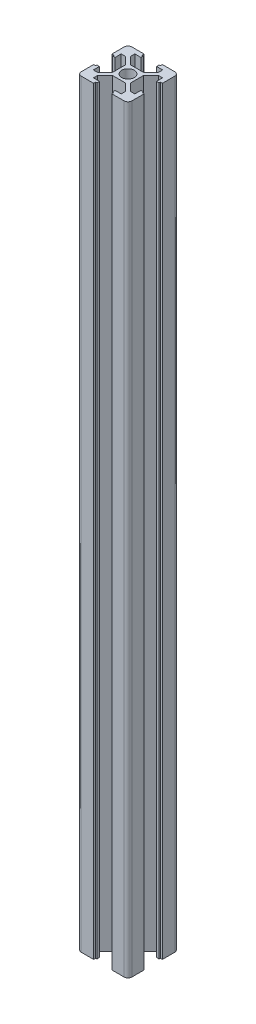
from build123d import *

# Parameters (mm, degrees)
SKETCH_1_R          = 2.5
EXTRUDE_1_DEPTH     = 300
SKETCH_2_R          = 1.75
CUT_EXTRUDE_1_DEPTH = 10


with BuildPart() as part:
    # 草图1 → 凸台-拉伸1 (new body)
    with BuildSketch(Plane(origin=(0, 0, 0), x_dir=(1, 0, 0), z_dir=(0, 1, 0))):
        with BuildLine():
            Line((-5.825824942, 5.993206118), (-5.825824942, 0.914526462))
            Line((-5.825824942, 0.914526462), (-8.786485114, -2.04613371))
            Line((-8.786485114, -2.04613371), (-10.425824942, -2.04613371))
            Line((-10.425824942, -2.04613371), (-10.425824942, 0.35386629))
            Line((-10.425824942, 0.35386629), (-11.425824942, 0.35386629))
            Line((-11.425824942, 0.35386629), (-11.425824942, -0.14613371))
            Line((-11.425824942, -0.14613371), (-12.225824942, -0.14613371))
            Line((-12.225824942, -0.14613371), (-12.225824942, -5.04613371))
            ThreePointArc((-12.225824942, -5.04613371), (-11.786485114, -6.106793882), (-10.725824942, -6.54613371))
            Line((-10.725824942, -6.54613371), (-5.825824942, -6.54613371))
            Line((-5.825824942, -6.54613371), (-5.825824942, -5.74613371))
            Line((-5.825824942, -5.74613371), (-5.325824942, -5.74613371))
            Line((-5.325824942, -5.74613371), (-5.325824942, -4.74613371))
            Line((-5.325824942, -4.74613371), (-7.725824942, -4.74613371))
            Line((-7.725824942, -4.74613371), (-7.725824942, -3.106793882))
            Line((-7.725824942, -3.106793882), (-4.765164771, -0.14613371))
            Line((-4.765164771, -0.14613371), (0.313514886, -0.14613371))
            Line((0.313514886, -0.14613371), (3.274175058, -3.106793882))
            Line((3.274175058, -3.106793882), (3.274175058, -4.74613371))
            Line((3.274175058, -4.74613371), (0.874175058, -4.74613371))
            Line((0.874175058, -4.74613371), (0.874175058, -5.74613371))
            Line((0.874175058, -5.74613371), (1.374175058, -5.74613371))
            Line((1.374175058, -5.74613371), (1.374175058, -6.54613371))
            Line((1.374175058, -6.54613371), (6.274175058, -6.54613371))
            ThreePointArc((6.274175058, -6.54613371), (7.334835229, -6.106793882), (7.774175058, -5.04613371))
            Line((7.774175058, -5.04613371), (7.774175058, -0.14613371))
            Line((7.774175058, -0.14613371), (6.974175058, -0.14613371))
            Line((6.974175058, -0.14613371), (6.974175058, 0.35386629))
            Line((6.974175058, 0.35386629), (5.974175058, 0.35386629))
            Line((5.974175058, 0.35386629), (5.974175058, -2.04613371))
            Line((5.974175058, -2.04613371), (4.334835229, -2.04613371))
            Line((4.334835229, -2.04613371), (1.374175058, 0.914526462))
            Line((1.374175058, 0.914526462), (1.374175058, 5.993206118))
            Line((1.374175058, 5.993206118), (4.334835229, 8.95386629))
            Line((4.334835229, 8.95386629), (5.974175058, 8.95386629))
            Line((5.974175058, 8.95386629), (5.974175058, 6.55386629))
            Line((5.974175058, 6.55386629), (6.974175058, 6.55386629))
            Line((6.974175058, 6.55386629), (6.974175058, 7.05386629))
            Line((6.974175058, 7.05386629), (7.774175058, 7.05386629))
            Line((7.774175058, 7.05386629), (7.774175058, 11.95386629))
            ThreePointArc((7.774175058, 11.95386629), (7.334835229, 13.014526462), (6.274175058, 13.45386629))
            Line((6.274175058, 13.45386629), (1.374175058, 13.45386629))
            Line((1.374175058, 13.45386629), (1.374175058, 12.65386629))
            Line((1.374175058, 12.65386629), (0.874175058, 12.65386629))
            Line((0.874175058, 12.65386629), (0.874175058, 11.65386629))
            Line((0.874175058, 11.65386629), (3.274175058, 11.65386629))
            Line((3.274175058, 11.65386629), (3.274175058, 10.014526462))
            Line((3.274175058, 10.014526462), (0.313514886, 7.05386629))
            Line((0.313514886, 7.05386629), (-4.765164771, 7.05386629))
            Line((-4.765164771, 7.05386629), (-7.725824942, 10.014526462))
            Line((-7.725824942, 10.014526462), (-7.725824942, 11.65386629))
            Line((-7.725824942, 11.65386629), (-5.325824942, 11.65386629))
            Line((-5.325824942, 11.65386629), (-5.325824942, 12.65386629))
            Line((-5.325824942, 12.65386629), (-5.825824942, 12.65386629))
            Line((-5.825824942, 12.65386629), (-5.825824942, 13.45386629))
            Line((-5.825824942, 13.45386629), (-10.725824942, 13.45386629))
            ThreePointArc((-10.725824942, 13.45386629), (-11.786485114, 13.014526462), (-12.225824942, 11.95386629))
            Line((-12.225824942, 11.95386629), (-12.225824942, 7.05386629))
            Line((-12.225824942, 7.05386629), (-11.425824942, 7.05386629))
            Line((-11.425824942, 7.05386629), (-11.425824942, 6.55386629))
            Line((-11.425824942, 6.55386629), (-10.425824942, 6.55386629))
            Line((-10.425824942, 6.55386629), (-10.425824942, 8.95386629))
            Line((-10.425824942, 8.95386629), (-8.786485114, 8.95386629))
            Line((-8.786485114, 8.95386629), (-5.825824942, 5.993206118))
        make_face()
        with Locations(Location((-2.225824942, 3.45386629, 0), (0, 0, 270))):
            Circle(SKETCH_1_R, mode=Mode.SUBTRACT)
    extrude(amount=EXTRUDE_1_DEPTH)

    # 草图2 → 切除-拉伸1 (cut)
    with BuildSketch(Plane.XY.offset(0.14613371)):
        with Locations((-2.225824942, 195)):
            Circle(SKETCH_2_R)
        with Locations((-2.225824942, 105)):
            Circle(SKETCH_2_R)
        with Locations((197.774175058, 105)):
            Circle(SKETCH_2_R)
        with Locations((197.774175058, 195)):
            Circle(SKETCH_2_R)
    extrude(amount=-CUT_EXTRUDE_1_DEPTH, mode=Mode.SUBTRACT)


solid = part.part
